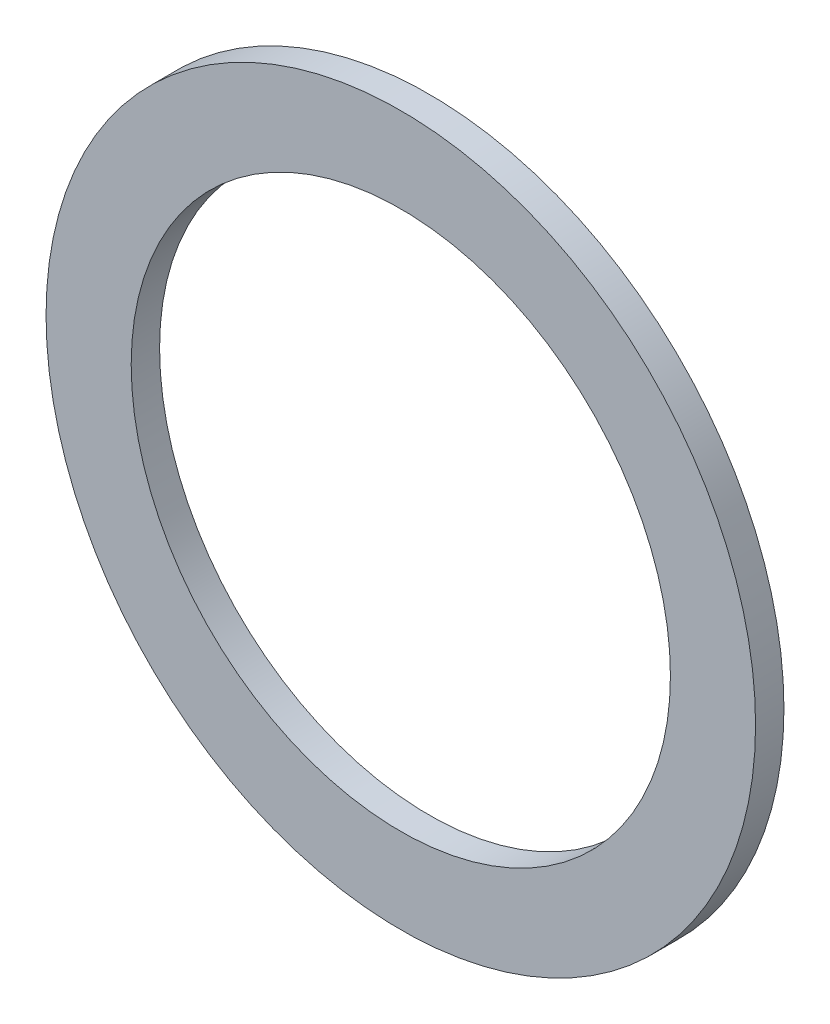
from build123d import *

# Parameters (mm, degrees)
SKIZZE1_R                       = 25
AUFSATZ_LINEAR_AUSTRAGEN1_DEPTH = 2
SKIZZE2_R                       = 19
SCHNITT_LINEAR_AUSTRAGEN1_DEPTH = 36.411862419


with BuildPart() as part:
    # Skizze1 → Aufsatz-Linear austragen1 (new body)
    with BuildSketch(Plane.XY):
        Circle(SKIZZE1_R)
    extrude(amount=AUFSATZ_LINEAR_AUSTRAGEN1_DEPTH)

    # Skizze2 → Schnitt-Linear austragen1 (cut, through all)
    with BuildSketch(Plane.XY.offset(2)):
        Circle(SKIZZE2_R)
    extrude(amount=-SCHNITT_LINEAR_AUSTRAGEN1_DEPTH, mode=Mode.SUBTRACT)


solid = part.part
